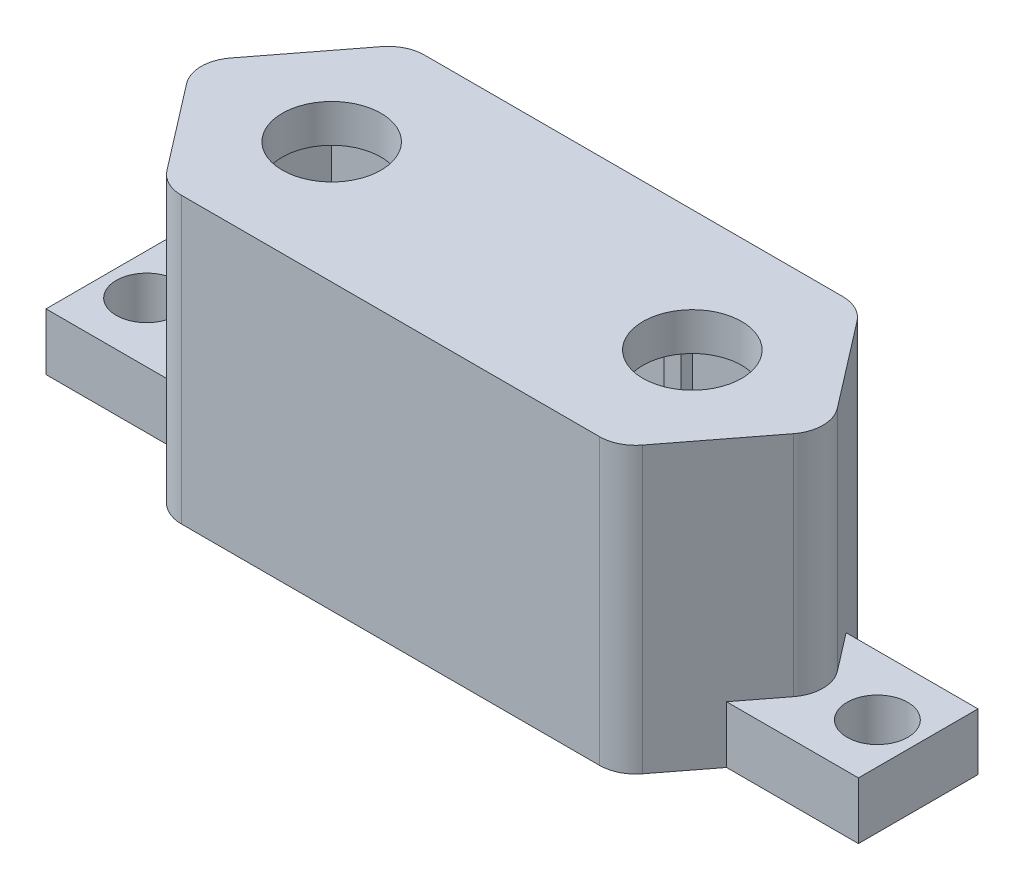
from build123d import *

# Parameters (mm, degrees)
SKETCH1_W           = 24
SKETCH1_H           = 13
BOSS_EXTRUDE1_DEPTH = 15
CUT_EXTRUDE1_DEPTH  = 13
SKETCH3_R           = 2.6
CUT_EXTRUDE2_DEPTH  = 2
CUT_EXTRUDE3_DEPTH  = 13
BOSS_EXTRUDE3_DEPTH = 8
SKETCH6_R           = 1.6
BOSS_EXTRUDE4_DEPTH = 3
FILLET1_R           = 2
CUT_EXTRUDE8_DEPTH  = 28.009257672
CUT_EXTRUDE9_DEPTH  = 12


with BuildPart() as part:
    # Sketch1 → Boss-Extrude1 (new body)
    with BuildSketch(Plane(origin=(0, 0, 0), x_dir=(1, 0, 0), z_dir=(0, 1, 0))):
        Polygon((-12, -6.5), (-12, 6.5), (-17, 0), align=None)
        Rectangle(SKETCH1_W, SKETCH1_H)
        Polygon((17, 0), (12, -6.5), (12, 6.5), align=None)
    extrude(amount=BOSS_EXTRUDE1_DEPTH)

    # Sketch2 → Cut-Extrude1 (cut)
    with BuildSketch(Plane.XZ):
        Polygon((-11.015197005, 4.5), (-14.476735467, 0), (-11.015197005, -4.5), (0, -4.5), (0, 4.5), align=None)
        Polygon((0, 4.5), (0, -4.5), (11.015197005, -4.5), (14.476735467, 0), (11.015197005, 4.5), align=None)
    extrude(amount=-CUT_EXTRUDE1_DEPTH, mode=Mode.SUBTRACT)

    # Sketch3 → Cut-Extrude2 (cut)
    with BuildSketch(Plane(origin=(0, 15, 0), x_dir=(1, 0, 0), z_dir=(0, 1, 0))):
        with Locations(Location((-9.5, 0, 0), (0, 0, 270))):
            Circle(SKETCH3_R)
        with Locations(Location((9.5, 0, 0), (0, 0, 270))):
            Circle(SKETCH3_R)
    extrude(amount=-CUT_EXTRUDE2_DEPTH, mode=Mode.SUBTRACT)

    # Sketch4 → Cut-Extrude3 (cut)
    with BuildSketch(Plane.XZ.offset(-13)):
        Polygon((-6.4, 2.5), (-5.5, 2.5), (-5.5, 4), (-13.5, 4), (-13.5, -4), (-5.5, -4), (-5.5, -2.5), (-6.4, -2.5), (-6.4, -3.1), (-12.092120082, -3.1), (-12.6, -2.439756107), (-12.6, 2.439756107), (-12.082269007, 3.1), (-6.4, 3.1), align=None)
        Polygon((6.4, 2.5), (6.4, 3.1), (12.082269007, 3.1), (12.6, 2.439756107), (12.6, -2.439756107), (12.092120082, -3.1), (6.4, -3.1), (6.4, -2.5), (5.5, -2.5), (5.5, -4), (13.5, -4), (13.5, 4), (5.5, 4), (5.5, 2.5), align=None)
    extrude(amount=CUT_EXTRUDE3_DEPTH, mode=Mode.SUBTRACT)

    # Sketch5 → Boss-Extrude3 (add)
    with BuildSketch(Plane.XZ.offset(-13)):
        Polygon((-6.4, -3.1), (-12.6, -3.1), (-12.6, 3.1), (-6.4, 3.1), (-6.4, 2.5), (-5.5, 2.5), (-5.5, 4), (-13.5, 4), (-13.5, -4), (-5.5, -4), (-5.5, -2.5), (-6.4, -2.5), align=None)
        Polygon((12.6, -3.1), (12.6, 3.1), (6.4, 3.1), (6.4, 2.5), (5.5, 2.5), (5.5, 4), (13.5, 4), (13.5, -4), (5.5, -4), (5.5, -2.5), (6.4, -2.5), (6.4, -3.1), align=None)
    extrude(amount=BOSS_EXTRUDE3_DEPTH)

    # Sketch6 → Boss-Extrude4 (add)
    # profile 1 of 2: a face of its own
    with BuildSketch(Plane(origin=(0, 0, 0), x_dir=(1, 0, 0), z_dir=(0, 1, 0))):
        Polygon((21.5, 3.25), (14.5, 3.25), (17, 0), (14.5, -3.25), (21.5, -3.25), align=None)
        with Locations(Location((19.25, 0, 0), (0, 0, 270))):
            Circle(SKETCH6_R, mode=Mode.SUBTRACT)
    # profile 2 of 2: a face of its own
    with BuildSketch(Plane(origin=(0, 0, 0), x_dir=(1, 0, 0), z_dir=(0, 1, 0))):
        Polygon((-17, 0), (-14.5, 3.25), (-21.5, 3.25), (-21.5, -3.25), (-14.5, -3.25), align=None)
        with Locations(Location((-19.25, 0, 0), (0, 0, 270))):
            Circle(SKETCH6_R, mode=Mode.SUBTRACT)
    extrude(amount=BOSS_EXTRUDE4_DEPTH)

    # Fillet1
    fillet1_edges = [part.edges().sort_by_distance(p)[0] for p in [
        (-17, 9, 0),
        (-12, 7.5, -6.5),
        (12, 7.5, -6.5),
        (17, 9, 0),
        (12, 7.5, 6.5),
        (-12, 7.5, 6.5),
    ]]
    fillet(fillet1_edges, radius=FILLET1_R)

    # Sketch8 → Cut-Extrude8 (cut, through all)
    with BuildSketch(Plane.XZ):
        with BuildLine():
            Line((-14.5, -3.25), (-21.5, -3.25))
            Line((-21.5, -3.25), (-21.5, 3.25))
            Line((-21.5, 3.25), (-14.5, 3.25))
            Line((-14.5, 3.25), (-12.600444983, 5.719421522))
            ThreePointArc((-12.600444983, 5.719421522), (-11.89870053, 6.294274651), (-11.015197005, 6.5))
            Line((-11.015197005, 6.5), (11.015197005, 6.5))
            ThreePointArc((11.015197005, 6.5), (11.89870053, 6.294274651), (12.600444983, 5.719421522))
            Line((12.600444983, 5.719421522), (14.5, 3.25))
            Line((14.5, 3.25), (21.5, 3.25))
            Line((21.5, 3.25), (21.5, -3.25))
            Line((21.5, -3.25), (14.5, -3.25))
            Line((14.5, -3.25), (12.600444983, -5.719421522))
            ThreePointArc((12.600444983, -5.719421522), (11.89870053, -6.294274651), (11.015197005, -6.5))
            Line((11.015197005, -6.5), (-11.015197005, -6.5))
            ThreePointArc((-11.015197005, -6.5), (-11.89870053, -6.294274651), (-12.600444983, -5.719421522))
            Line((-12.600444983, -5.719421522), (-14.5, -3.25))
        make_face()
        with BuildLine():
            Line((-14.45075985, -3.15), (-21.4, -3.15))
            Line((-21.4, -3.15), (-21.4, 3.15))
            Line((-21.4, 3.15), (-14.45075985, 3.15))
            Line((-14.45075985, 3.15), (-12.521182584, 5.658450446))
            ThreePointArc((-12.521182584, 5.658450446), (-11.854525354, 6.204560918), (-11.015197005, 6.4))
            Line((-11.015197005, 6.4), (11.015197005, 6.4))
            ThreePointArc((11.015197005, 6.4), (11.854525354, 6.204560918), (12.521182584, 5.658450446))
            Line((12.521182584, 5.658450446), (14.45075985, 3.15))
            Line((14.45075985, 3.15), (21.4, 3.15))
            Line((21.4, 3.15), (21.4, -3.15))
            Line((21.4, -3.15), (14.45075985, -3.15))
            Line((14.45075985, -3.15), (12.521182584, -5.658450446))
            ThreePointArc((12.521182584, -5.658450446), (11.854525354, -6.204560918), (11.015197005, -6.4))
            Line((11.015197005, -6.4), (-11.015197005, -6.4))
            ThreePointArc((-11.015197005, -6.4), (-11.854525354, -6.204560918), (-12.521182584, -5.658450446))
            Line((-12.521182584, -5.658450446), (-14.45075985, -3.15))
        make_face(mode=Mode.SUBTRACT)
    extrude(amount=-CUT_EXTRUDE8_DEPTH, mode=Mode.SUBTRACT)

    # Sketch9 → Cut-Extrude9 (cut)
    with BuildSketch(Plane(origin=(0, 15, 0), x_dir=(1, 0, 0), z_dir=(0, 1, 0))):
        with BuildLine():
            Line((14.576923077, -3.15), (14.45075985, -3.15))
            Line((14.45075985, -3.15), (14.527682927, -3.05))
            Line((14.527682927, -3.05), (15.982721046, -1.158450446))
            ThreePointArc((15.982721046, -1.158450446), (16.376735467, 0), (15.982721046, 1.158450446))
            Line((15.982721046, 1.158450446), (14.527682927, 3.05))
            Line((14.527682927, 3.05), (14.45075985, 3.15))
            Line((14.45075985, 3.15), (14.576923077, 3.15))
            Line((14.576923077, 3.15), (16.061983445, 1.219421522))
            ThreePointArc((16.061983445, 1.219421522), (16.476735467, 0), (16.061983445, -1.219421522))
            Line((16.061983445, -1.219421522), (14.576923077, -3.15))
        make_face()
        with BuildLine():
            Line((-14.45075985, -3.15), (-14.576923077, -3.15))
            Line((-14.576923077, -3.15), (-16.061983445, -1.219421522))
            ThreePointArc((-16.061983445, -1.219421522), (-16.476735467, 0), (-16.061983445, 1.219421522))
            Line((-16.061983445, 1.219421522), (-14.576923077, 3.15))
            Line((-14.576923077, 3.15), (-14.45075985, 3.15))
            Line((-14.45075985, 3.15), (-14.527682927, 3.05))
            Line((-14.527682927, 3.05), (-15.982721046, 1.158450446))
            ThreePointArc((-15.982721046, 1.158450446), (-16.376735467, 0), (-15.982721046, -1.158450446))
            Line((-15.982721046, -1.158450446), (-14.527682927, -3.05))
            Line((-14.527682927, -3.05), (-14.45075985, -3.15))
        make_face()
    extrude(amount=-CUT_EXTRUDE9_DEPTH, mode=Mode.SUBTRACT)


solid = part.part
